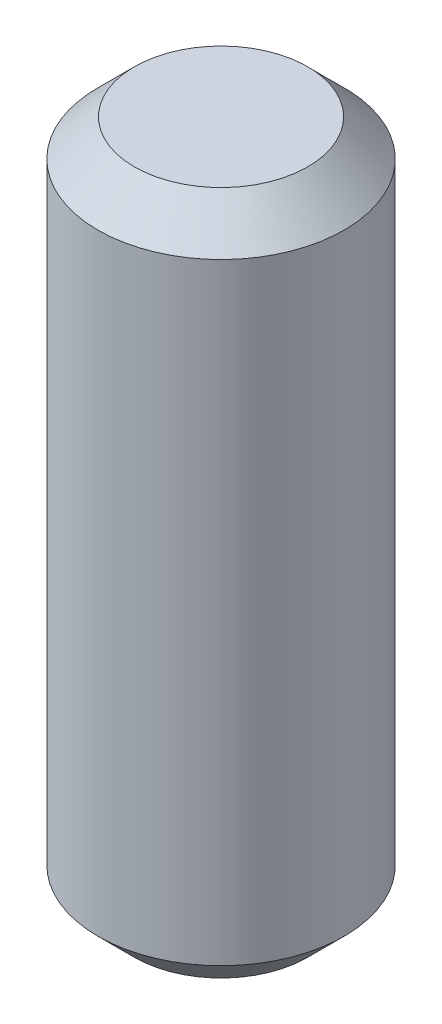
from build123d import *

# Parameters (mm, degrees)
SKETCH1_R           = 2.7
BOSS_EXTRUDE1_DEPTH = 15
CHAMFER1_SIZE       = 0.8


with BuildPart() as part:
    # Sketch1 → Boss-Extrude1 (new body)
    with BuildSketch(Plane(origin=(0, 0, 0), x_dir=(1, 0, 0), z_dir=(0, 1, 0))):
        with Locations(Location((0, 0, 0), (0, 0, 270))):
            Circle(SKETCH1_R)
    extrude(amount=BOSS_EXTRUDE1_DEPTH)

    # Chamfer1
    chamfer1_edges = [part.edges().sort_by_distance(p)[0] for p in [
        (0, 0, -2.7),
        (0, 15, -2.7),
    ]]
    chamfer(chamfer1_edges, length=CHAMFER1_SIZE)


solid = part.part
